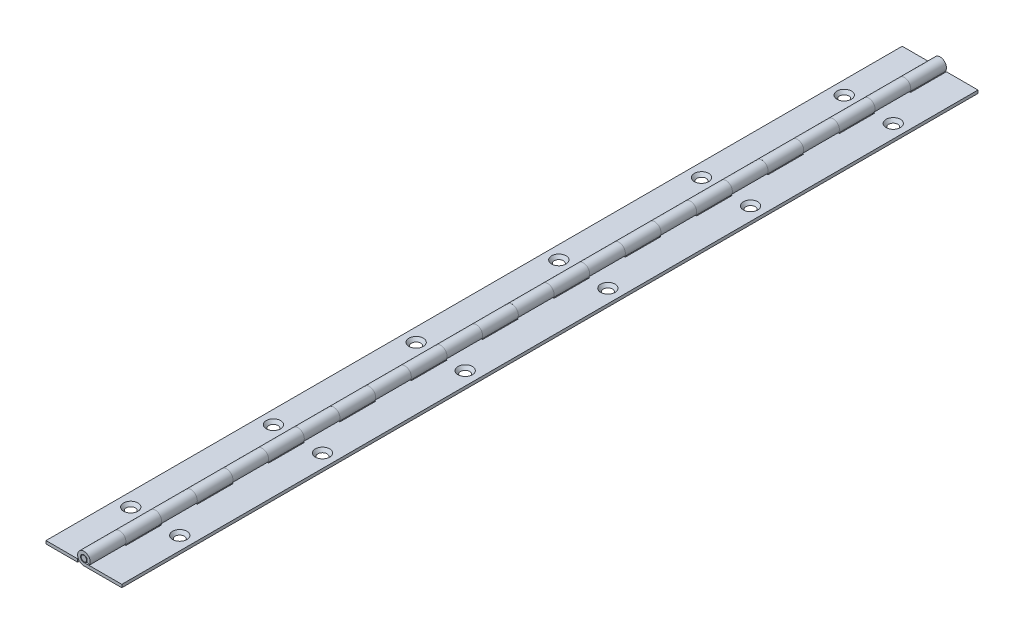
from build123d import *

# Parameters (mm, degrees)
EXTRUDE1_DEPTH            = 152.4
SKETCH3_W                 = 4.51358
SKETCH3_H                 = 12.7
CUT_EXTRUDE1_DEPTH        = 25.4
LPATTERN1_COUNT           = 12
LPATTERN1_PITCH           = 25.4
EXTRUDE2_DEPTH            = 12.7
LPATTERN3_COUNT           = 12
LPATTERN3_PITCH           = 25.4
SKETCH6_W                 = 11.21156
SKETCH6_H                 = 1.0668
EXTRUDE5_DEPTH            = 304.8
SKETCH10_R                = 1.63195
CUT_EXTRUDE2_DEPTH        = 1.0668
CUT_EXTRUDE2_DRAFT        = -41
LPATTERN4_COPY_1_SKETCH_R = 1.63195
LPATTERN4_COPY_1_DEPTH    = 1.0668
LPATTERN4_COPY_1_DRAFT    = -41
LPATTERN4_COPY_2_SKETCH_R = 1.63195
LPATTERN4_COPY_2_DEPTH    = 1.0668
LPATTERN4_COPY_2_DRAFT    = -41
LPATTERN4_COPY_3_SKETCH_R = 1.63195
LPATTERN4_COPY_3_DEPTH    = 1.0668
LPATTERN4_COPY_3_DRAFT    = -41
LPATTERN4_COPY_4_SKETCH_R = 1.63195
LPATTERN4_COPY_4_DEPTH    = 1.0668
LPATTERN4_COPY_4_DRAFT    = -41
LPATTERN4_COPY_5_SKETCH_R = 1.63195
LPATTERN4_COPY_5_DEPTH    = 1.0668
LPATTERN4_COPY_5_DRAFT    = -41
MIRROR3_COPY_1_SKETCH_R   = 1.63195
MIRROR3_COPY_1_DEPTH      = 1.0668
MIRROR3_COPY_1_DRAFT      = -41
MIRROR3_COPY_2_SKETCH_R   = 1.63195
MIRROR3_COPY_2_DEPTH      = 1.0668
MIRROR3_COPY_2_DRAFT      = -41
MIRROR3_COPY_3_SKETCH_R   = 1.63195
MIRROR3_COPY_3_DEPTH      = 1.0668
MIRROR3_COPY_3_DRAFT      = -41
MIRROR3_COPY_4_SKETCH_R   = 1.63195
MIRROR3_COPY_4_DEPTH      = 1.0668
MIRROR3_COPY_4_DRAFT      = -41
MIRROR3_COPY_5_SKETCH_R   = 1.63195
MIRROR3_COPY_5_DEPTH      = 1.0668
MIRROR3_COPY_5_DRAFT      = -41
MIRROR3_COPY_6_SKETCH_R   = 1.63195
MIRROR3_COPY_6_DEPTH      = 1.0668
MIRROR3_COPY_6_DRAFT      = -41
SKETCH7_R                 = 1.190625
EXTRUDE4_DEPTH            = 152.4
CHAMFER1_SIZE             = 0.238125


with BuildPart() as part:
    # Sketch2 → Extrude1 (new, symmetric)
    with BuildSketch(Plane.XY):
        with BuildLine():
            Line((13.49375, -1.18999), (13.49375, -2.25679))
            Line((13.49375, -2.25679), (0, -2.25679))
            ThreePointArc((0, -2.25679), (-1.212572383, 1.903357381), (2.045346351, -0.953760667))
            Line((2.045346351, -0.953760667), (1.079072709, -0.503179868))
            ThreePointArc((1.079072709, -0.503179868), (-0.623239132, 1.014475665), (-0.038880465, -1.18999))
            Line((-0.038880465, -1.18999), (13.49375, -1.18999))
        make_face()
    extrude(amount=EXTRUDE1_DEPTH, both=True)

    # Sketch3 → Cut-Extrude1 (cut, symmetric)
    with BuildSketch(Plane(origin=(0, -1.18999, 0), x_dir=(1, 0, 0), z_dir=(0, 1, 0))):
        with Locations((0, 146.05)):
            Rectangle(SKETCH3_W, SKETCH3_H)
    cut_extrude1 = extrude(amount=CUT_EXTRUDE1_DEPTH, both=True, mode=Mode.SUBTRACT)

    # LPattern1: Cut-Extrude1 ×12
    with Locations(*[(0, 0, i * LPATTERN1_PITCH) for i in range(1, LPATTERN1_COUNT)]):
        add(cut_extrude1, mode=Mode.SUBTRACT)


with BuildPart() as body_2:
    # Sketch5 → Extrude2 (new body)
    with BuildSketch(Plane(origin=(0, 0, -152.4), x_dir=(-1, 0, 0), z_dir=(0, 0, -1))):
        with BuildLine():
            Line((0.038880465, -1.18999), (13.49375, -1.18999))
            Line((13.49375, -1.18999), (13.49375, -2.25679))
            Line((13.49375, -2.25679), (0, -2.25679))
            ThreePointArc((0, -2.25679), (-1.212572383, 1.903357381), (2.045346351, -0.953760667))
            Line((2.045346351, -0.953760667), (1.079072709, -0.503179868))
            ThreePointArc((1.079072709, -0.503179868), (-0.656034956, 0.993582421), (0.038880465, -1.18999))
        make_face()
    extrude(amount=-EXTRUDE2_DEPTH)


with BuildPart() as lpattern3_1:
    # LPattern3: pattern copy
    add(body_2.part.moved(Location(Vector(0, 0, 1) * (1 * LPATTERN3_PITCH))))


with BuildPart() as lpattern3_2:
    # LPattern3: pattern copy
    add(body_2.part.moved(Location(Vector(0, 0, 1) * (2 * LPATTERN3_PITCH))))


with BuildPart() as lpattern3_3:
    # LPattern3: pattern copy
    add(body_2.part.moved(Location(Vector(0, 0, 1) * (3 * LPATTERN3_PITCH))))


with BuildPart() as lpattern3_4:
    # LPattern3: pattern copy
    add(body_2.part.moved(Location(Vector(0, 0, 1) * (4 * LPATTERN3_PITCH))))


with BuildPart() as lpattern3_5:
    # LPattern3: pattern copy
    add(body_2.part.moved(Location(Vector(0, 0, 1) * (5 * LPATTERN3_PITCH))))


with BuildPart() as lpattern3_6:
    # LPattern3: pattern copy
    add(body_2.part.moved(Location(Vector(0, 0, 1) * (6 * LPATTERN3_PITCH))))


with BuildPart() as lpattern3_7:
    # LPattern3: pattern copy
    add(body_2.part.moved(Location(Vector(0, 0, 1) * (7 * LPATTERN3_PITCH))))


with BuildPart() as lpattern3_8:
    # LPattern3: pattern copy
    add(body_2.part.moved(Location(Vector(0, 0, 1) * (8 * LPATTERN3_PITCH))))


with BuildPart() as lpattern3_9:
    # LPattern3: pattern copy
    add(body_2.part.moved(Location(Vector(0, 0, 1) * (9 * LPATTERN3_PITCH))))


with BuildPart() as lpattern3_10:
    # LPattern3: pattern copy
    add(body_2.part.moved(Location(Vector(0, 0, 1) * (10 * LPATTERN3_PITCH))))


with BuildPart() as lpattern3_11:
    # LPattern3: pattern copy
    add(body_2.part.moved(Location(Vector(0, 0, 1) * (11 * LPATTERN3_PITCH))))


with BuildPart() as body_2_1:
    add(body_2.part)

    add(lpattern3_1.part)  # Extrude5 merges LPattern3_1

    add(lpattern3_2.part)  # Extrude5 merges LPattern3_2

    add(lpattern3_3.part)  # Extrude5 merges LPattern3_3

    add(lpattern3_4.part)  # Extrude5 merges LPattern3_4

    add(lpattern3_5.part)  # Extrude5 merges LPattern3_5

    add(lpattern3_6.part)  # Extrude5 merges LPattern3_6

    add(lpattern3_7.part)  # Extrude5 merges LPattern3_7

    add(lpattern3_8.part)  # Extrude5 merges LPattern3_8

    add(lpattern3_9.part)  # Extrude5 merges LPattern3_9

    add(lpattern3_10.part)  # Extrude5 merges LPattern3_10

    add(lpattern3_11.part)  # Extrude5 merges LPattern3_11
    # Sketch6 → Extrude5 (add)
    with BuildSketch(Plane(origin=(0, 0, -152.4), x_dir=(-1, 0, 0), z_dir=(0, 0, -1))):
        with Locations((7.88797, -1.72339)):
            Rectangle(SKETCH6_W, SKETCH6_H)
    extrude(amount=-EXTRUDE5_DEPTH)


with BuildPart() as cut_extrude2_tool:
    # Sketch10 → Cut-Extrude2 (with draft: the straight prism first)
    with BuildSketch(Plane(origin=(0, -2.25679, 0), x_dir=(1, 0, 0), z_dir=(0, 1, 0))):
        with Locations((8.73125, 127)):
            Circle(SKETCH10_R)
    extrude(amount=CUT_EXTRUDE2_DEPTH)
    # Cut-Extrude2: the draft: its side faces are tilted about the plane it starts from
    cut_extrude2_sides = [cut_extrude2_tool.faces().sort_by_distance(p)[0] for p in [
        (7.0993, -1.72339, -127),
    ]]
    draft(cut_extrude2_sides, Plane(origin=(0, -2.25679, 0), x_dir=(1, 0, 0), z_dir=(0, 1, 0)), CUT_EXTRUDE2_DRAFT)


with BuildPart() as part_1:
    add(part.part)

    # Cut-Extrude2: cut by cut_extrude2_tool
    add(cut_extrude2_tool.part, mode=Mode.SUBTRACT)


with BuildPart() as lpattern4_copy_1_tool:
    # LPattern4 copy 1 sketch → LPattern4 copy 1 (with draft: the straight prism first)
    with BuildSketch(Plane(origin=(0, -2.25679, 50.8), x_dir=(1, 0, 0), z_dir=(0, 1, 0))):
        with Locations((8.73125, 127)):
            Circle(LPATTERN4_COPY_1_SKETCH_R)
    extrude(amount=LPATTERN4_COPY_1_DEPTH)
    # LPattern4 copy 1: the draft: its side faces are tilted about the plane it starts from
    lpattern4_copy_1_sides = [lpattern4_copy_1_tool.faces().sort_by_distance(p)[0] for p in [
        (7.0993, -1.72339, -76.2),
    ]]
    draft(lpattern4_copy_1_sides, Plane(origin=(0, -2.25679, 50.8), x_dir=(1, 0, 0), z_dir=(0, 1, 0)), LPATTERN4_COPY_1_DRAFT)


with BuildPart() as part_2:
    add(part_1.part)

    # LPattern4 copy 1: cut by lpattern4_copy_1_tool
    add(lpattern4_copy_1_tool.part, mode=Mode.SUBTRACT)


with BuildPart() as lpattern4_copy_2_tool:
    # LPattern4 copy 2 sketch → LPattern4 copy 2 (with draft: the straight prism first)
    with BuildSketch(Plane(origin=(0, -2.25679, 101.6), x_dir=(1, 0, 0), z_dir=(0, 1, 0))):
        with Locations((8.73125, 127)):
            Circle(LPATTERN4_COPY_2_SKETCH_R)
    extrude(amount=LPATTERN4_COPY_2_DEPTH)
    # LPattern4 copy 2: the draft: its side faces are tilted about the plane it starts from
    lpattern4_copy_2_sides = [lpattern4_copy_2_tool.faces().sort_by_distance(p)[0] for p in [
        (7.0993, -1.72339, -25.4),
    ]]
    draft(lpattern4_copy_2_sides, Plane(origin=(0, -2.25679, 101.6), x_dir=(1, 0, 0), z_dir=(0, 1, 0)), LPATTERN4_COPY_2_DRAFT)


with BuildPart() as part_3:
    add(part_2.part)

    # LPattern4 copy 2: cut by lpattern4_copy_2_tool
    add(lpattern4_copy_2_tool.part, mode=Mode.SUBTRACT)


with BuildPart() as lpattern4_copy_3_tool:
    # LPattern4 copy 3 sketch → LPattern4 copy 3 (with draft: the straight prism first)
    with BuildSketch(Plane(origin=(0, -2.25679, 152.4), x_dir=(1, 0, 0), z_dir=(0, 1, 0))):
        with Locations((8.73125, 127)):
            Circle(LPATTERN4_COPY_3_SKETCH_R)
    extrude(amount=LPATTERN4_COPY_3_DEPTH)
    # LPattern4 copy 3: the draft: its side faces are tilted about the plane it starts from
    lpattern4_copy_3_sides = [lpattern4_copy_3_tool.faces().sort_by_distance(p)[0] for p in [
        (7.0993, -1.72339, 25.4),
    ]]
    draft(lpattern4_copy_3_sides, Plane(origin=(0, -2.25679, 152.4), x_dir=(1, 0, 0), z_dir=(0, 1, 0)), LPATTERN4_COPY_3_DRAFT)


with BuildPart() as part_4:
    add(part_3.part)

    # LPattern4 copy 3: cut by lpattern4_copy_3_tool
    add(lpattern4_copy_3_tool.part, mode=Mode.SUBTRACT)


with BuildPart() as lpattern4_copy_4_tool:
    # LPattern4 copy 4 sketch → LPattern4 copy 4 (with draft: the straight prism first)
    with BuildSketch(Plane(origin=(0, -2.25679, 203.2), x_dir=(1, 0, 0), z_dir=(0, 1, 0))):
        with Locations((8.73125, 127)):
            Circle(LPATTERN4_COPY_4_SKETCH_R)
    extrude(amount=LPATTERN4_COPY_4_DEPTH)
    # LPattern4 copy 4: the draft: its side faces are tilted about the plane it starts from
    lpattern4_copy_4_sides = [lpattern4_copy_4_tool.faces().sort_by_distance(p)[0] for p in [
        (7.0993, -1.72339, 76.2),
    ]]
    draft(lpattern4_copy_4_sides, Plane(origin=(0, -2.25679, 203.2), x_dir=(1, 0, 0), z_dir=(0, 1, 0)), LPATTERN4_COPY_4_DRAFT)


with BuildPart() as part_5:
    add(part_4.part)

    # LPattern4 copy 4: cut by lpattern4_copy_4_tool
    add(lpattern4_copy_4_tool.part, mode=Mode.SUBTRACT)


with BuildPart() as lpattern4_copy_5_tool:
    # LPattern4 copy 5 sketch → LPattern4 copy 5 (with draft: the straight prism first)
    with BuildSketch(Plane(origin=(0, -2.25679, 254), x_dir=(1, 0, 0), z_dir=(0, 1, 0))):
        with Locations((8.73125, 127)):
            Circle(LPATTERN4_COPY_5_SKETCH_R)
    extrude(amount=LPATTERN4_COPY_5_DEPTH)
    # LPattern4 copy 5: the draft: its side faces are tilted about the plane it starts from
    lpattern4_copy_5_sides = [lpattern4_copy_5_tool.faces().sort_by_distance(p)[0] for p in [
        (7.0993, -1.72339, 127),
    ]]
    draft(lpattern4_copy_5_sides, Plane(origin=(0, -2.25679, 254), x_dir=(1, 0, 0), z_dir=(0, 1, 0)), LPATTERN4_COPY_5_DRAFT)


with BuildPart() as part_6:
    add(part_5.part)

    # LPattern4 copy 5: cut by lpattern4_copy_5_tool
    add(lpattern4_copy_5_tool.part, mode=Mode.SUBTRACT)


with BuildPart() as mirror3_copy_1_tool:
    # Mirror3 copy 1 sketch → Mirror3 copy 1 (with draft: the straight prism first)
    with BuildSketch(Plane(origin=(0, -2.25679, 0), x_dir=(-1, 0, 0), z_dir=(0, 1, 0))):
        with Locations((8.73125, -127)):
            Circle(MIRROR3_COPY_1_SKETCH_R)
    extrude(amount=MIRROR3_COPY_1_DEPTH)
    # Mirror3 copy 1: the draft: its side faces are tilted about the plane it starts from
    mirror3_copy_1_sides = [mirror3_copy_1_tool.faces().sort_by_distance(p)[0] for p in [
        (-7.0993, -1.72339, -127),
    ]]
    draft(mirror3_copy_1_sides, Plane(origin=(0, -2.25679, 0), x_dir=(-1, 0, 0), z_dir=(0, 1, 0)), MIRROR3_COPY_1_DRAFT)


with BuildPart() as body_2_2:
    add(body_2_1.part)

    # Mirror3 copy 1: cut by mirror3_copy_1_tool
    add(mirror3_copy_1_tool.part, mode=Mode.SUBTRACT)


with BuildPart() as mirror3_copy_2_tool:
    # Mirror3 copy 2 sketch → Mirror3 copy 2 (with draft: the straight prism first)
    with BuildSketch(Plane(origin=(0, -2.25679, 50.8), x_dir=(-1, 0, 0), z_dir=(0, 1, 0))):
        with Locations((8.73125, -127)):
            Circle(MIRROR3_COPY_2_SKETCH_R)
    extrude(amount=MIRROR3_COPY_2_DEPTH)
    # Mirror3 copy 2: the draft: its side faces are tilted about the plane it starts from
    mirror3_copy_2_sides = [mirror3_copy_2_tool.faces().sort_by_distance(p)[0] for p in [
        (-7.0993, -1.72339, -76.2),
    ]]
    draft(mirror3_copy_2_sides, Plane(origin=(0, -2.25679, 50.8), x_dir=(-1, 0, 0), z_dir=(0, 1, 0)), MIRROR3_COPY_2_DRAFT)


with BuildPart() as body_2_3:
    add(body_2_2.part)

    # Mirror3 copy 2: cut by mirror3_copy_2_tool
    add(mirror3_copy_2_tool.part, mode=Mode.SUBTRACT)


with BuildPart() as mirror3_copy_3_tool:
    # Mirror3 copy 3 sketch → Mirror3 copy 3 (with draft: the straight prism first)
    with BuildSketch(Plane(origin=(0, -2.25679, 101.6), x_dir=(-1, 0, 0), z_dir=(0, 1, 0))):
        with Locations((8.73125, -127)):
            Circle(MIRROR3_COPY_3_SKETCH_R)
    extrude(amount=MIRROR3_COPY_3_DEPTH)
    # Mirror3 copy 3: the draft: its side faces are tilted about the plane it starts from
    mirror3_copy_3_sides = [mirror3_copy_3_tool.faces().sort_by_distance(p)[0] for p in [
        (-7.0993, -1.72339, -25.4),
    ]]
    draft(mirror3_copy_3_sides, Plane(origin=(0, -2.25679, 101.6), x_dir=(-1, 0, 0), z_dir=(0, 1, 0)), MIRROR3_COPY_3_DRAFT)


with BuildPart() as body_2_4:
    add(body_2_3.part)

    # Mirror3 copy 3: cut by mirror3_copy_3_tool
    add(mirror3_copy_3_tool.part, mode=Mode.SUBTRACT)


with BuildPart() as mirror3_copy_4_tool:
    # Mirror3 copy 4 sketch → Mirror3 copy 4 (with draft: the straight prism first)
    with BuildSketch(Plane(origin=(0, -2.25679, 152.4), x_dir=(-1, 0, 0), z_dir=(0, 1, 0))):
        with Locations((8.73125, -127)):
            Circle(MIRROR3_COPY_4_SKETCH_R)
    extrude(amount=MIRROR3_COPY_4_DEPTH)
    # Mirror3 copy 4: the draft: its side faces are tilted about the plane it starts from
    mirror3_copy_4_sides = [mirror3_copy_4_tool.faces().sort_by_distance(p)[0] for p in [
        (-7.0993, -1.72339, 25.4),
    ]]
    draft(mirror3_copy_4_sides, Plane(origin=(0, -2.25679, 152.4), x_dir=(-1, 0, 0), z_dir=(0, 1, 0)), MIRROR3_COPY_4_DRAFT)


with BuildPart() as body_2_5:
    add(body_2_4.part)

    # Mirror3 copy 4: cut by mirror3_copy_4_tool
    add(mirror3_copy_4_tool.part, mode=Mode.SUBTRACT)


with BuildPart() as mirror3_copy_5_tool:
    # Mirror3 copy 5 sketch → Mirror3 copy 5 (with draft: the straight prism first)
    with BuildSketch(Plane(origin=(0, -2.25679, 203.2), x_dir=(-1, 0, 0), z_dir=(0, 1, 0))):
        with Locations((8.73125, -127)):
            Circle(MIRROR3_COPY_5_SKETCH_R)
    extrude(amount=MIRROR3_COPY_5_DEPTH)
    # Mirror3 copy 5: the draft: its side faces are tilted about the plane it starts from
    mirror3_copy_5_sides = [mirror3_copy_5_tool.faces().sort_by_distance(p)[0] for p in [
        (-7.0993, -1.72339, 76.2),
    ]]
    draft(mirror3_copy_5_sides, Plane(origin=(0, -2.25679, 203.2), x_dir=(-1, 0, 0), z_dir=(0, 1, 0)), MIRROR3_COPY_5_DRAFT)


with BuildPart() as body_2_6:
    add(body_2_5.part)

    # Mirror3 copy 5: cut by mirror3_copy_5_tool
    add(mirror3_copy_5_tool.part, mode=Mode.SUBTRACT)


with BuildPart() as mirror3_copy_6_tool:
    # Mirror3 copy 6 sketch → Mirror3 copy 6 (with draft: the straight prism first)
    with BuildSketch(Plane(origin=(0, -2.25679, 254), x_dir=(-1, 0, 0), z_dir=(0, 1, 0))):
        with Locations((8.73125, -127)):
            Circle(MIRROR3_COPY_6_SKETCH_R)
    extrude(amount=MIRROR3_COPY_6_DEPTH)
    # Mirror3 copy 6: the draft: its side faces are tilted about the plane it starts from
    mirror3_copy_6_sides = [mirror3_copy_6_tool.faces().sort_by_distance(p)[0] for p in [
        (-7.0993, -1.72339, 127),
    ]]
    draft(mirror3_copy_6_sides, Plane(origin=(0, -2.25679, 254), x_dir=(-1, 0, 0), z_dir=(0, 1, 0)), MIRROR3_COPY_6_DRAFT)


with BuildPart() as body_2_7:
    add(body_2_6.part)

    # Mirror3 copy 6: cut by mirror3_copy_6_tool
    add(mirror3_copy_6_tool.part, mode=Mode.SUBTRACT)


with BuildPart() as body_3:
    # Sketch7 → Extrude4 (new, symmetric)
    with BuildSketch(Plane.XY):
        with Locations(Location((0, 0, 0), (0, 0, 180))):
            Circle(SKETCH7_R)
    extrude(amount=EXTRUDE4_DEPTH, both=True)

    # Chamfer1
    chamfer1_edges = [body_3.edges().sort_by_distance(p)[0] for p in [
        (1.190625, 0, -152.4),
        (1.190625, 0, 152.4),
    ]]
    chamfer(chamfer1_edges, length=CHAMFER1_SIZE)


solid = Compound([part_6.part, body_2_7.part, body_3.part])
